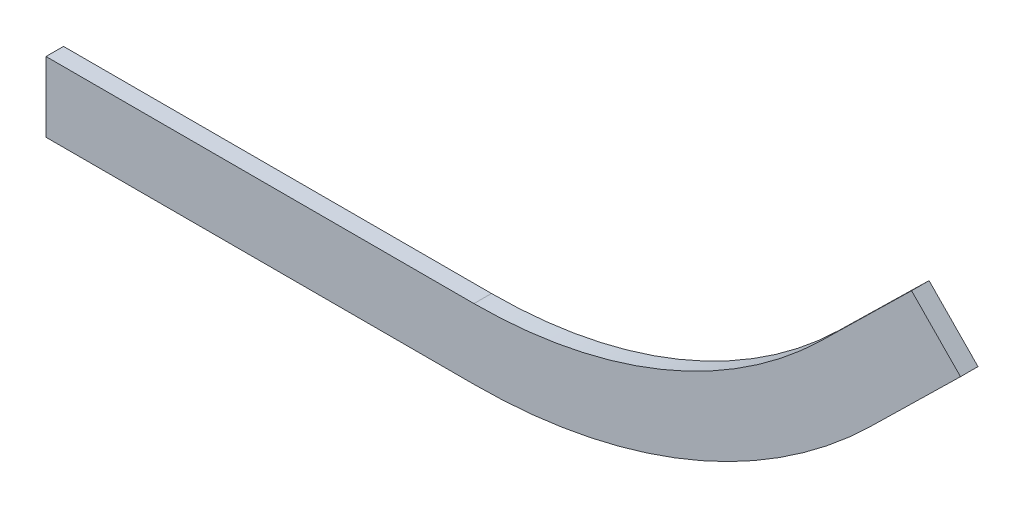
from build123d import *

# Parameters (mm, degrees)
BOSS_EXTRUDE1_DEPTH = 5


with BuildPart() as part:
    # Sketch4 → Boss-Extrude1 (new, symmetric)
    with BuildSketch(Plane.XY):
        with BuildLine():
            Line((50, 40), (244.655381072, 40))
            ThreePointArc((244.655381072, 40), (351.936835728, 61.042418845), (443.320675573, 121.051482487))
            Line((443.320675573, 121.051482487), (459.066489093, 136.464981035))
            Line((459.066489093, 136.464981035), (494.796861895, 171.441265278))
            Line((494.796861895, 171.441265278), (522.777889288, 142.856967039))
            Line((522.777889288, 142.856967039), (487.047516486, 107.880682795))
            Line((487.047516486, 107.880682795), (471.305428262, 92.47083092))
            ThreePointArc((471.305428262, 92.47083092), (367.046513526, 24.007086549), (244.650168029, 0))
            Line((244.650168029, 0), (50, 0))
            Line((50, 0), (0, 0))
            Line((0, 0), (0, 40))
            Line((0, 40), (50, 40))
        make_face()
    extrude(amount=BOSS_EXTRUDE1_DEPTH, both=True)


solid = part.part
